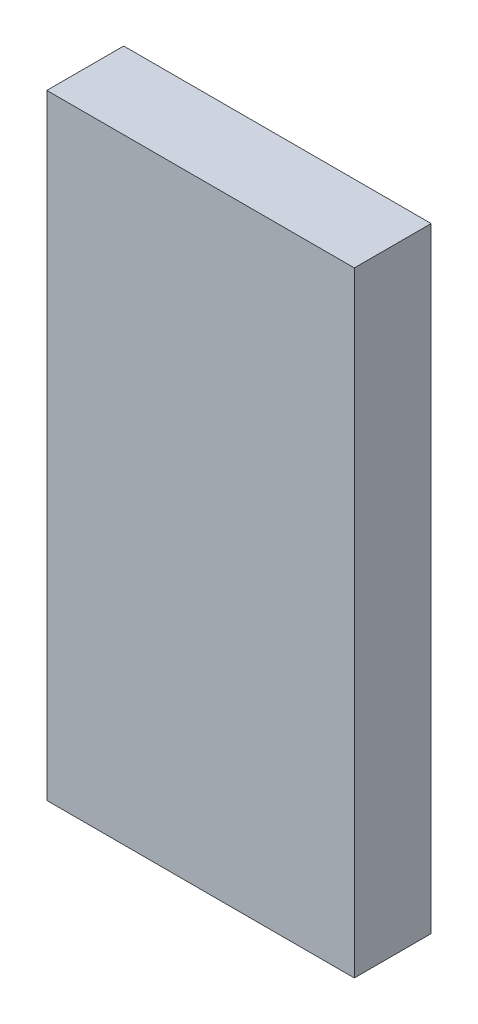
from build123d import *

# Parameters (mm, degrees)
SKETCH1_W           = 25.4
SKETCH1_H           = 50.8
BOSS_EXTRUDE1_DEPTH = 3.175


with BuildPart() as part:
    # Sketch1 → Boss-Extrude1 (new, symmetric)
    with BuildSketch(Plane.XY):
        Rectangle(SKETCH1_W, SKETCH1_H)
    extrude(amount=BOSS_EXTRUDE1_DEPTH, both=True)


solid = part.part
